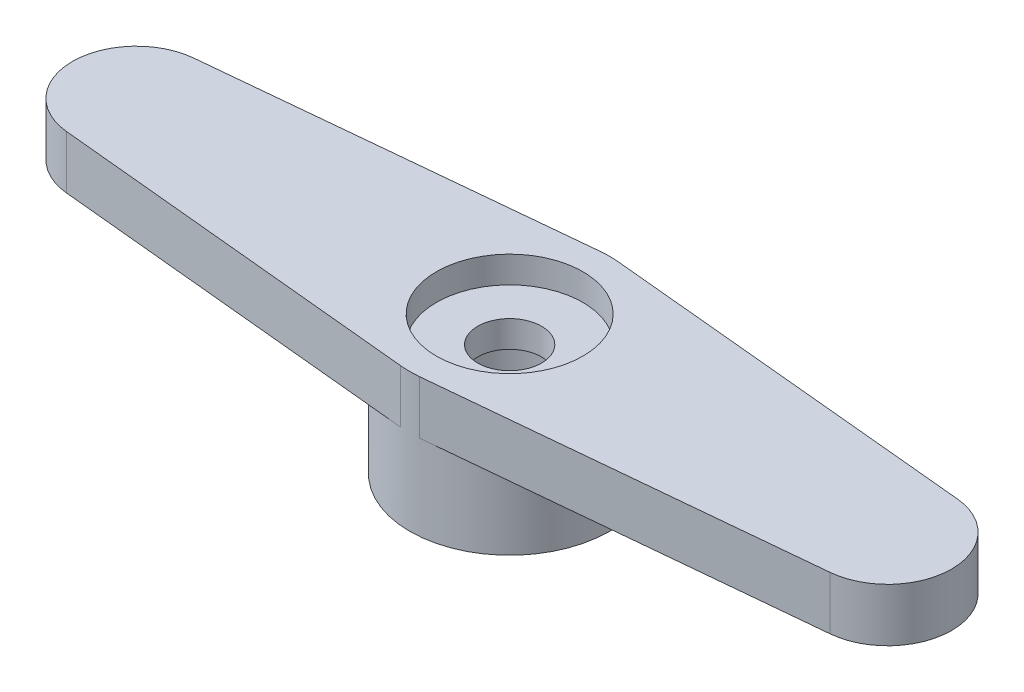
from build123d import *
from build123d.topology import SkipClean

# Parameters (mm, degrees)
SKETCH1_R           = 1.2
BOSS_EXTRUDE1_DEPTH = 2
BOSS_EXTRUDE2_START = 3.2
SKETCH2_R           = 1.2
BOSS_EXTRUDE2_DEPTH = 3.2
SKETCH3_R           = 2.4
CUT_EXTRUDE3_DEPTH  = 3.2
SKETCH4_R           = 2.75
CUT_EXTRUDE4_DEPTH  = 1


with BuildPart() as part:
    # Sketch1 → Boss-Extrude1 (new body)
    with BuildSketch(Plane(origin=(0, 0, 0), x_dir=(1, 0, 0), z_dir=(0, 1, 0))):
        with BuildLine():
            Line((0.356514085, 3.73301456), (14.428169014, 2.389129319))
            ThreePointArc((14.428169014, 2.389129319), (16.6, 0), (14.428169014, -2.389129319))
            Line((14.428169014, -2.389129319), (0.356514085, -3.73301456))
            ThreePointArc((0.356514085, -3.73301456), (-0.00225279, -3.749999323), (-0.360998998, -3.732583519))
            Line((-0.360998998, -3.732583519), (-14.254623989, -2.388853452))
            ThreePointArc((-14.254623989, -2.388853452), (-16.42358463, 0), (-14.254623989, 2.388853452))
            Line((-14.254623989, 2.388853452), (-0.360998998, 3.732583519))
            ThreePointArc((-0.360998998, 3.732583519), (-0.00225279, 3.749999323), (0.356514085, 3.73301456))
        make_face()
        with Locations(Location((0, 0, 0), (0, 0, 270))):
            Circle(SKETCH1_R, mode=Mode.SUBTRACT)
    extrude(amount=BOSS_EXTRUDE1_DEPTH)

    # Sketch2 → Boss-Extrude2 (add)
    with SkipClean():  # the faces are left unmerged after this step: merging them gives an invalid solid
        with BuildSketch(Plane.XZ.offset(BOSS_EXTRUDE2_START)):
            with BuildLine():
                ThreePointArc((3.75, 0), (2.774835835, 2.522456361), (0.356514085, 3.73301456))
                ThreePointArc((0.356514085, 3.73301456), (-0.00225279, 3.749999323), (-0.360998998, 3.732583519))
                ThreePointArc((-0.360998998, 3.732583519), (-3.75, 0), (-0.360998998, -3.732583519))
                ThreePointArc((-0.360998998, -3.732583519), (-0.00225279, -3.749999323), (0.356514085, -3.73301456))
                ThreePointArc((0.356514085, -3.73301456), (2.774835835, -2.522456361), (3.75, 0))
            make_face()
            with Locations(Location((0, 0, 0), (0, 0, 270))):
                Circle(SKETCH2_R, mode=Mode.SUBTRACT)
        extrude(amount=-BOSS_EXTRUDE2_DEPTH)

    # Sketch3 → Cut-Extrude3 (cut)
    with BuildSketch(Plane.XZ.offset(3.2)):
        with Locations(Location((0, 0, 0), (0, 0, 270))):
            Circle(SKETCH3_R)
    extrude(amount=-CUT_EXTRUDE3_DEPTH, mode=Mode.SUBTRACT)

    # Sketch4 → Cut-Extrude4 (cut)
    with BuildSketch(Plane(origin=(0, 2, 0), x_dir=(1, 0, 0), z_dir=(0, 1, 0))):
        with Locations(Location((0, 0, 0), (0, 0, 270))):
            Circle(SKETCH4_R)
    extrude(amount=-CUT_EXTRUDE4_DEPTH, mode=Mode.SUBTRACT)


solid = part.part
